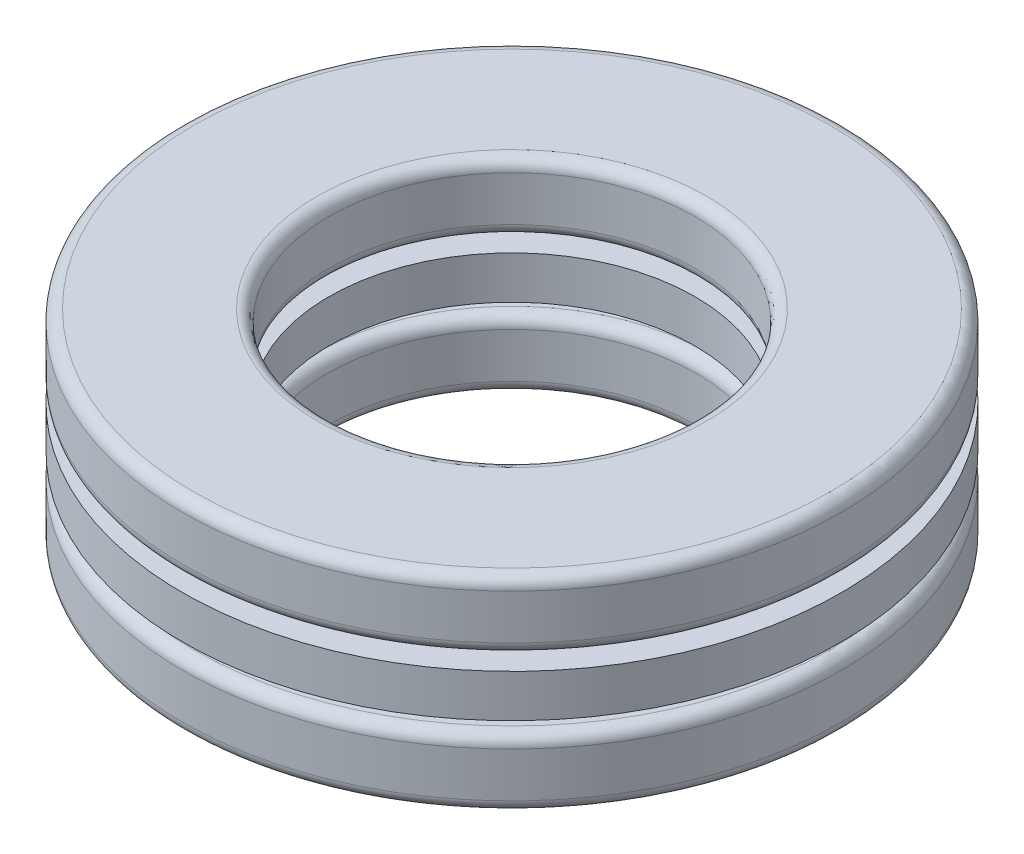
from build123d import *

# Parameters (mm, degrees)
SKETCH1_W         = 10
SKETCH1_H         = 2.916666666
CIRPATTERN1_COUNT = 17
CIRPATTERN1_ANGLE = 338.823529412
CIRPATTERN2_COUNT = 17


with BuildPart() as part:
    # Sketch1 → Revolve1 (revolve)
    with BuildSketch(Plane(origin=(0, 0, 0), x_dir=(0, 0, -1), z_dir=(1, 0, 0)), mode=Mode.PRIVATE) as revolve1_sk:
        with Locations((-17.5, 0)):
            Rectangle(SKETCH1_W, SKETCH1_H)
    revolve(revolve1_sk.sketch.rotate(Axis((0, -7, 0), (0, 1, 0)), 180), axis=Axis((0, -7, 0), (0, 1, 0)))

    # Sketch3 → Cut-Revolve1 (revolve, cut)
    with BuildSketch(Plane(origin=(0, 0, 0), x_dir=(0, 0, -1), z_dir=(1, 0, 0))):
        with BuildLine():
            Line((-17.5, 2.333333333), (-17.5, -2.333333333))
            ThreePointArc((-17.5, -2.333333333), (-19.833333333, 0), (-17.5, 2.333333333))
        make_face()
    cut_revolve1 = revolve(axis=Axis((0, 2.333333333, 17.5), (0, -1, 0)), mode=Mode.SUBTRACT)

    # CirPattern2: Cut-Revolve1 ×17 about axis
    cirpattern2_axis = Axis((0, 0, 0), (0, 1, 0))
    for i in range(1, CIRPATTERN2_COUNT):
        add(cut_revolve1.rotate(cirpattern2_axis, i * 360 / CIRPATTERN2_COUNT), mode=Mode.SUBTRACT)


with BuildPart() as body_2:
    # Sketch2 → Revolve2 (revolve)
    with BuildSketch(Plane(origin=(0, 0, 0), x_dir=(0, 0, -1), z_dir=(1, 0, 0))):
        with BuildLine():
            Line((-17.5, 2.333333333), (-17.5, -2.333333333))
            ThreePointArc((-17.5, -2.333333333), (-19.833333333, 0), (-17.5, 2.333333333))
        make_face()
    revolve(axis=Axis((0, 2.333333333, 17.5), (0, -1, 0)))


with BuildPart() as cirpattern1_1:
    # CirPattern1: pattern copy
    add(body_2.part.rotate(Axis((0, 7, 0), (0, -1, 0)), 1 * CIRPATTERN1_ANGLE / (CIRPATTERN1_COUNT - 1)))


with BuildPart() as cirpattern1_2:
    # CirPattern1: pattern copy
    add(body_2.part.rotate(Axis((0, 7, 0), (0, -1, 0)), 2 * CIRPATTERN1_ANGLE / (CIRPATTERN1_COUNT - 1)))


with BuildPart() as cirpattern1_3:
    # CirPattern1: pattern copy
    add(body_2.part.rotate(Axis((0, 7, 0), (0, -1, 0)), 3 * CIRPATTERN1_ANGLE / (CIRPATTERN1_COUNT - 1)))


with BuildPart() as cirpattern1_4:
    # CirPattern1: pattern copy
    add(body_2.part.rotate(Axis((0, 7, 0), (0, -1, 0)), 4 * CIRPATTERN1_ANGLE / (CIRPATTERN1_COUNT - 1)))


with BuildPart() as cirpattern1_5:
    # CirPattern1: pattern copy
    add(body_2.part.rotate(Axis((0, 7, 0), (0, -1, 0)), 5 * CIRPATTERN1_ANGLE / (CIRPATTERN1_COUNT - 1)))


with BuildPart() as cirpattern1_6:
    # CirPattern1: pattern copy
    add(body_2.part.rotate(Axis((0, 7, 0), (0, -1, 0)), 6 * CIRPATTERN1_ANGLE / (CIRPATTERN1_COUNT - 1)))


with BuildPart() as cirpattern1_7:
    # CirPattern1: pattern copy
    add(body_2.part.rotate(Axis((0, 7, 0), (0, -1, 0)), 7 * CIRPATTERN1_ANGLE / (CIRPATTERN1_COUNT - 1)))


with BuildPart() as cirpattern1_8:
    # CirPattern1: pattern copy
    add(body_2.part.rotate(Axis((0, 7, 0), (0, -1, 0)), 8 * CIRPATTERN1_ANGLE / (CIRPATTERN1_COUNT - 1)))


with BuildPart() as cirpattern1_9:
    # CirPattern1: pattern copy
    add(body_2.part.rotate(Axis((0, 7, 0), (0, -1, 0)), 9 * CIRPATTERN1_ANGLE / (CIRPATTERN1_COUNT - 1)))


with BuildPart() as cirpattern1_10:
    # CirPattern1: pattern copy
    add(body_2.part.rotate(Axis((0, 7, 0), (0, -1, 0)), 10 * CIRPATTERN1_ANGLE / (CIRPATTERN1_COUNT - 1)))


with BuildPart() as cirpattern1_11:
    # CirPattern1: pattern copy
    add(body_2.part.rotate(Axis((0, 7, 0), (0, -1, 0)), 11 * CIRPATTERN1_ANGLE / (CIRPATTERN1_COUNT - 1)))


with BuildPart() as cirpattern1_12:
    # CirPattern1: pattern copy
    add(body_2.part.rotate(Axis((0, 7, 0), (0, -1, 0)), 12 * CIRPATTERN1_ANGLE / (CIRPATTERN1_COUNT - 1)))


with BuildPart() as cirpattern1_13:
    # CirPattern1: pattern copy
    add(body_2.part.rotate(Axis((0, 7, 0), (0, -1, 0)), 13 * CIRPATTERN1_ANGLE / (CIRPATTERN1_COUNT - 1)))


with BuildPart() as cirpattern1_14:
    # CirPattern1: pattern copy
    add(body_2.part.rotate(Axis((0, 7, 0), (0, -1, 0)), 14 * CIRPATTERN1_ANGLE / (CIRPATTERN1_COUNT - 1)))


with BuildPart() as cirpattern1_15:
    # CirPattern1: pattern copy
    add(body_2.part.rotate(Axis((0, 7, 0), (0, -1, 0)), 15 * CIRPATTERN1_ANGLE / (CIRPATTERN1_COUNT - 1)))


with BuildPart() as cirpattern1_16:
    # CirPattern1: pattern copy
    add(body_2.part.rotate(Axis((0, 7, 0), (0, -1, 0)), 16 * CIRPATTERN1_ANGLE / (CIRPATTERN1_COUNT - 1)))


with BuildPart() as body_19:
    # Sketch4 → Revolve3 (revolve)
    with BuildSketch(Plane(origin=(0, 0, 0), x_dir=(0, 0, -1), z_dir=(1, 0, 0)), mode=Mode.PRIVATE) as revolve3_sk:
        with BuildLine():
            Line((-21.7, 7), (-13.3, 7))
            ThreePointArc((-13.3, 7), (-12.734314575, 6.765685425), (-12.5, 6.2))
            Line((-12.5, 6.2), (-12.5, 3.133333333))
            ThreePointArc((-12.5, 3.133333333), (-12.734314575, 2.567647908), (-13.3, 2.333333333))
            Line((-13.3, 2.333333333), (-21.7, 2.333333333))
            ThreePointArc((-21.7, 2.333333333), (-22.265685425, 2.567647908), (-22.5, 3.133333333))
            Line((-22.5, 3.133333333), (-22.5, 6.2))
            ThreePointArc((-22.5, 6.2), (-22.265685425, 6.765685425), (-21.7, 7))
        make_face()
        with BuildLine():
            Line((-21.7, -7), (-13.4, -7))
            ThreePointArc((-13.4, -7), (-12.834314575, -6.765685425), (-12.6, -6.2))
            Line((-12.6, -6.2), (-12.6, -3.133333333))
            ThreePointArc((-12.6, -3.133333333), (-12.834314575, -2.567647908), (-13.4, -2.333333333))
            Line((-13.4, -2.333333333), (-21.7, -2.333333333))
            ThreePointArc((-21.7, -2.333333333), (-22.265685425, -2.567647908), (-22.5, -3.133333333))
            Line((-22.5, -3.133333333), (-22.5, -6.2))
            ThreePointArc((-22.5, -6.2), (-22.265685425, -6.765685425), (-21.7, -7))
        make_face()
    revolve(revolve3_sk.sketch.rotate(Axis((0, -7, 0), (0, 1, 0)), 180), axis=Axis((0, -7, 0), (0, 1, 0)))


solid = Compound([part.part, body_2.part, cirpattern1_1.part, cirpattern1_2.part, cirpattern1_3.part, cirpattern1_4.part, cirpattern1_5.part, cirpattern1_6.part, cirpattern1_7.part, cirpattern1_8.part, cirpattern1_9.part, cirpattern1_10.part, cirpattern1_11.part, cirpattern1_12.part, cirpattern1_13.part, cirpattern1_14.part, cirpattern1_15.part, cirpattern1_16.part, body_19.part])
